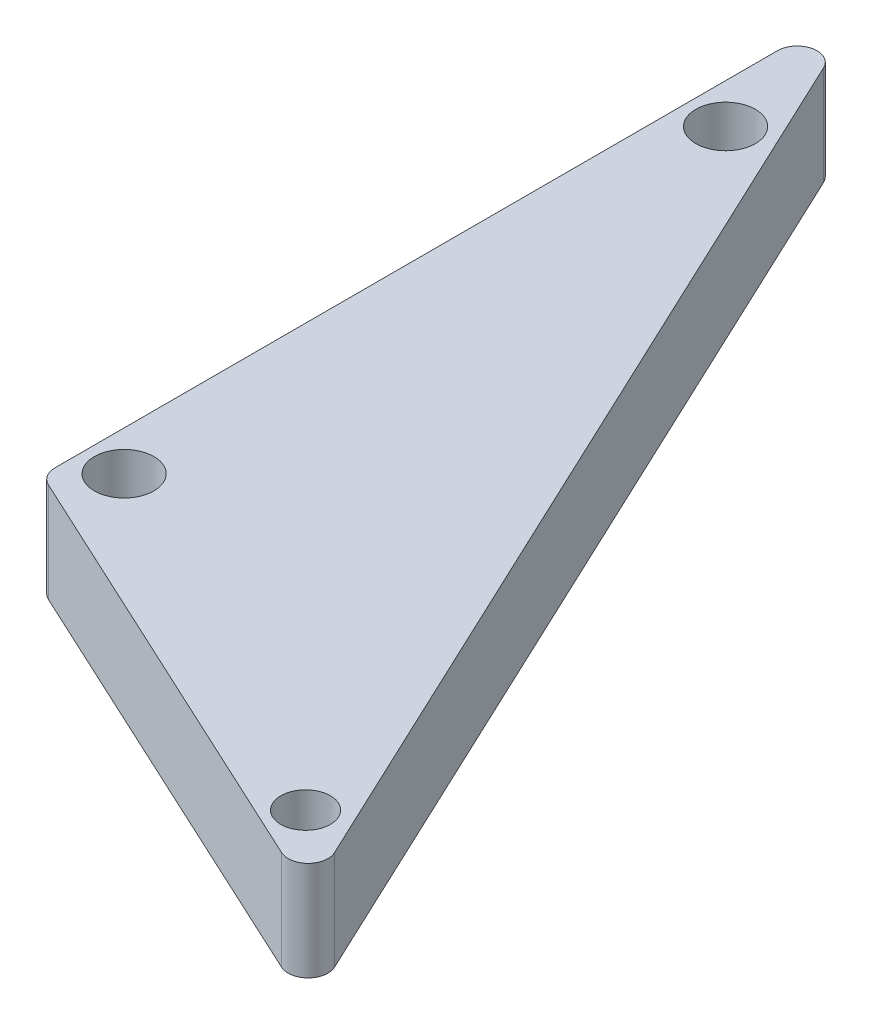
from build123d import *

# Parameters (mm, degrees)
BOSS_EXTRUDE1_DEPTH = 12.7
SKETCH2_R           = 3.81
SKETCH2_R_2         = 3.175
CUT_EXTRUDE1_DEPTH  = 124.712602834
FILLET1_R           = 2.54


with BuildPart() as part:
    # Sketch1 → Boss-Extrude1 (new body)
    with BuildSketch(Plane(origin=(0, 0, 0), x_dir=(1, 0, 0), z_dir=(0, 1, 0))):
        Polygon((0, 0), (0, 105.41), (63.5, -29.464), align=None)
    extrude(amount=BOSS_EXTRUDE1_DEPTH)

    # Sketch2 → Cut-Extrude1 (cut, through all)
    with BuildSketch(Plane.XZ):
        with Locations(Location((5.08, -82.347196418, 0), (0, 0, 270))):
            Circle(SKETCH2_R)
        with Locations(Location((5.08, -5.39556681, 0), (0, 0, 270))):
            Circle(SKETCH2_R)
        with Locations(Location((53.955653889, 20.261534242, 0), (0, 0, 270))):
            Circle(SKETCH2_R_2)
    extrude(amount=-CUT_EXTRUDE1_DEPTH, mode=Mode.SUBTRACT)

    # Fillet1
    fillet1_edges = [part.edges().sort_by_distance(p)[0] for p in [
        (0, 6.35, 0),
        (0, 6.35, -105.41),
        (63.5, 6.35, 29.464),
    ]]
    fillet(fillet1_edges, radius=FILLET1_R)


solid = part.part
